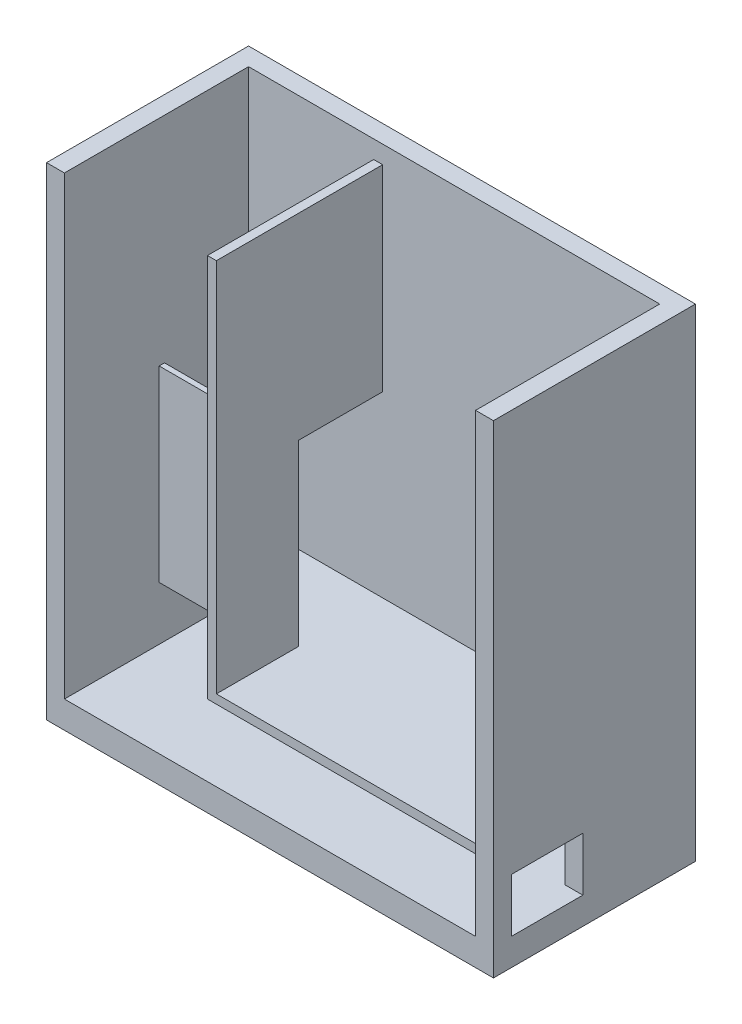
from build123d import *

# Parameters (mm, degrees)
SKETCH1_W            = 125
SKETCH1_H            = 135
BOSS_EXTRUDE1_DEPTH  = 5
SKETCH2_W            = 5
SKETCH2_H            = 135
BOSS_EXTRUDE2_DEPTH  = 51.5
SKETCH3_W            = 5
SKETCH3_H            = 135
BOSS_EXTRUDE3_DEPTH  = 51.5
SKETCH5_W            = 115
SKETCH5_H            = 7.57
BOSS_EXTRUDE4_DEPTH  = 51.5
SKETCH21_W           = 2.5
SKETCH21_H           = 55
BOSS_EXTRUDE13_DEPTH = 46.5
SKETCH23_W           = 115
SKETCH23_H           = 2.5
BOSS_EXTRUDE14_DEPTH = 25
BOSS_EXTRUDE15_REACH = 177.789
SKETCH24_W           = 35
SKETCH24_H           = 1.5
SKETCH25_W           = 80
SKETCH25_H           = 2.5
BOSS_EXTRUDE16_DEPTH = 26.5
SKETCH27_W           = 2.5
SKETCH27_H           = 28
BOSS_EXTRUDE20_DEPTH = 104.93
CUT_EXTRUDE1_REACH   = 188.414
SKETCH28_W           = 35
SKETCH28_H           = 55
SKETCH29_W           = 80
SKETCH29_H           = 5
CUT_EXTRUDE2_DEPTH   = 178.363341477
SKETCH35_W           = 20
SKETCH35_H           = 15
CUT_EXTRUDE5_DEPTH   = 7.5


with BuildPart() as part:
    # Sketch1 → Boss-Extrude1 (new body)
    with BuildSketch(Plane.XY):
        with Locations((62.5, 67.5)):
            Rectangle(SKETCH1_W, SKETCH1_H)
    extrude(amount=BOSS_EXTRUDE1_DEPTH)

    # Sketch2 → Boss-Extrude2 (add)
    with BuildSketch(Plane.XY.offset(5)):
        with Locations((2.5, 67.5)):
            Rectangle(SKETCH2_W, SKETCH2_H)
    extrude(amount=BOSS_EXTRUDE2_DEPTH)

    # Sketch3 → Boss-Extrude3 (add)
    with BuildSketch(Plane.XY.offset(5)):
        with Locations((122.5, 67.5)):
            Rectangle(SKETCH3_W, SKETCH3_H)
    extrude(amount=BOSS_EXTRUDE3_DEPTH)

    # Sketch5 → Boss-Extrude4 (add)
    with BuildSketch(Plane.XY.offset(5)):
        with Locations((62.5, 3.785)):
            Rectangle(SKETCH5_W, SKETCH5_H)
    extrude(amount=BOSS_EXTRUDE4_DEPTH)

    # Sketch21 → Boss-Extrude13 (add)
    with BuildSketch(Plane.XY.offset(5)):
        with Locations((41.25, 102.5)):
            Rectangle(SKETCH21_W, SKETCH21_H)
    extrude(amount=BOSS_EXTRUDE13_DEPTH)

    # Sketch23 → Boss-Extrude14 (add)
    with BuildSketch(Plane.XY.offset(5)):
        with Locations((62.5, 23.82)):
            Rectangle(SKETCH23_W, SKETCH23_H)
    extrude(amount=BOSS_EXTRUDE14_DEPTH)

    # Boss-Extrude15: up to this face of the body (flat: up to its plane)
    boss_extrude15_end = Plane(part.part.faces().sort_by_distance((41.25, 130, 28.25))[0])
    # Sketch24 → Boss-Extrude15 (add, up to the picked face)
    with BuildSketch(Plane(origin=(0, 25.07, 0), x_dir=(1, 0, 0), z_dir=(0, 1, 0)), mode=Mode.PRIVATE) as boss_extrude15_sk1:
        with Locations((22.5, -29.25)):
            Rectangle(SKETCH24_W, SKETCH24_H)
    boss_extrude15_tool1 = split(extrude(boss_extrude15_sk1.sketch, amount=BOSS_EXTRUDE15_REACH, mode=Mode.PRIVATE), bisect_by=boss_extrude15_end, keep=Keep.BOTH, mode=Mode.PRIVATE)
    add(boss_extrude15_tool1.solids().sort_by(Axis((22.5, 25.07, 29.25), (0, 1, 0)))[0])

    # Sketch25 → Boss-Extrude16 (add)
    with BuildSketch(Plane.XY.offset(30)):
        with Locations((80, 23.82)):
            Rectangle(SKETCH25_W, SKETCH25_H)
    extrude(amount=BOSS_EXTRUDE16_DEPTH)

    # Sketch27 → Boss-Extrude20 (add)
    with BuildSketch(Plane(origin=(0, 25.07, 0), x_dir=(1, 0, 0), z_dir=(0, 1, 0))):
        with Locations((41.25, -42.5)):
            Rectangle(SKETCH27_W, SKETCH27_H)
    extrude(amount=BOSS_EXTRUDE20_DEPTH)

    # Sketch28 → Cut-Extrude1 (cut, up to next)
    with BuildSketch(Plane.XY.offset(30), mode=Mode.PRIVATE) as cut_extrude1_sk1:
        with Locations((22.5, 102.5)):
            Rectangle(SKETCH28_W, SKETCH28_H)
    cut_extrude1_tool1 = extrude(cut_extrude1_sk1.sketch, amount=-CUT_EXTRUDE1_REACH, mode=Mode.PRIVATE) & part.part
    add(cut_extrude1_tool1.solids().sort_by_distance((22.5, 102.5, 30))[0], mode=Mode.SUBTRACT)

    # Sketch29 → Cut-Extrude2 (cut, through all)
    with BuildSketch(Plane.XZ.offset(-22.57)):
        with Locations((80, 54)):
            Rectangle(SKETCH29_W, SKETCH29_H)
    extrude(amount=-CUT_EXTRUDE2_DEPTH, mode=Mode.SUBTRACT)

    # Sketch35 → Cut-Extrude5 (cut)
    with BuildSketch(Plane(origin=(125, 0, 0), x_dir=(0, 0, -1), z_dir=(1, 0, 0))):
        with Locations((-41.5, 15.07)):
            Rectangle(SKETCH35_W, SKETCH35_H)
    extrude(amount=-CUT_EXTRUDE5_DEPTH, mode=Mode.SUBTRACT)


solid = part.part
